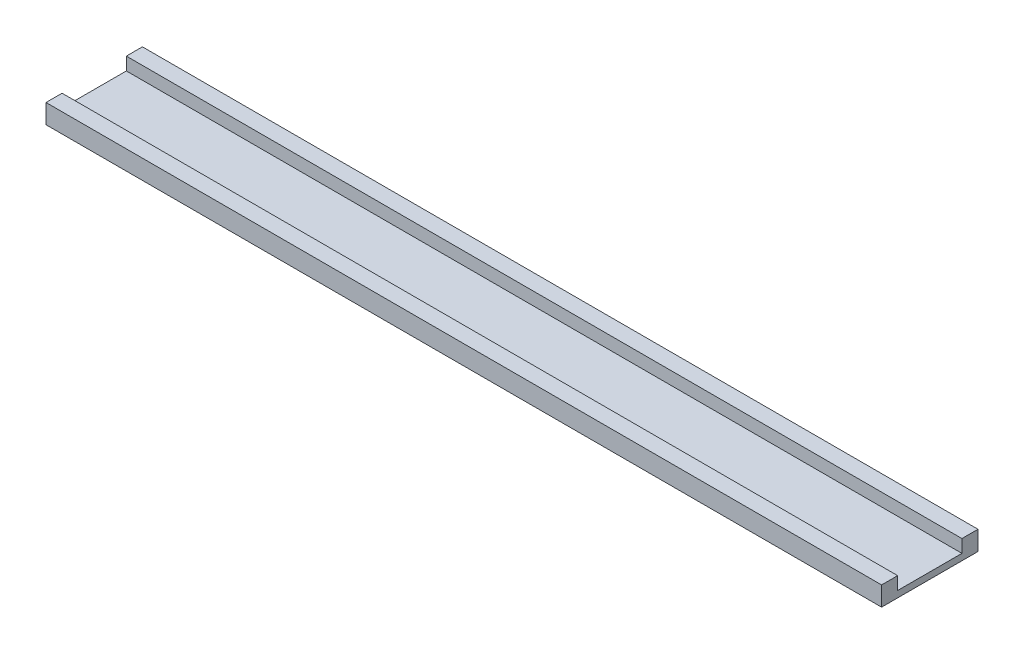
from build123d import *

# Parameters (mm, degrees)
IZIM1_W                     = 130
IZIM1_H                     = 15
Y_KSEKLIK_EKSTR_ZYON1_DEPTH = 3
IZIM2_W                     = 130
IZIM2_H                     = 10
KES_EKSTR_ZYON1_DEPTH       = 2


with BuildPart() as part:
    # Çizim1 → Yükseklik-Ekstrüzyon1 (new body)
    with BuildSketch(Plane(origin=(0, 0, 0), x_dir=(1, 0, 0), z_dir=(0, 1, 0))):
        Rectangle(IZIM1_W, IZIM1_H)
    extrude(amount=Y_KSEKLIK_EKSTR_ZYON1_DEPTH)

    # Çizim2 → Kes-Ekstrüzyon1 (cut)
    with BuildSketch(Plane(origin=(0, 3, 0), x_dir=(1, 0, 0), z_dir=(0, 1, 0))):
        Rectangle(IZIM2_W, IZIM2_H)
    extrude(amount=-KES_EKSTR_ZYON1_DEPTH, mode=Mode.SUBTRACT)


solid = part.part
